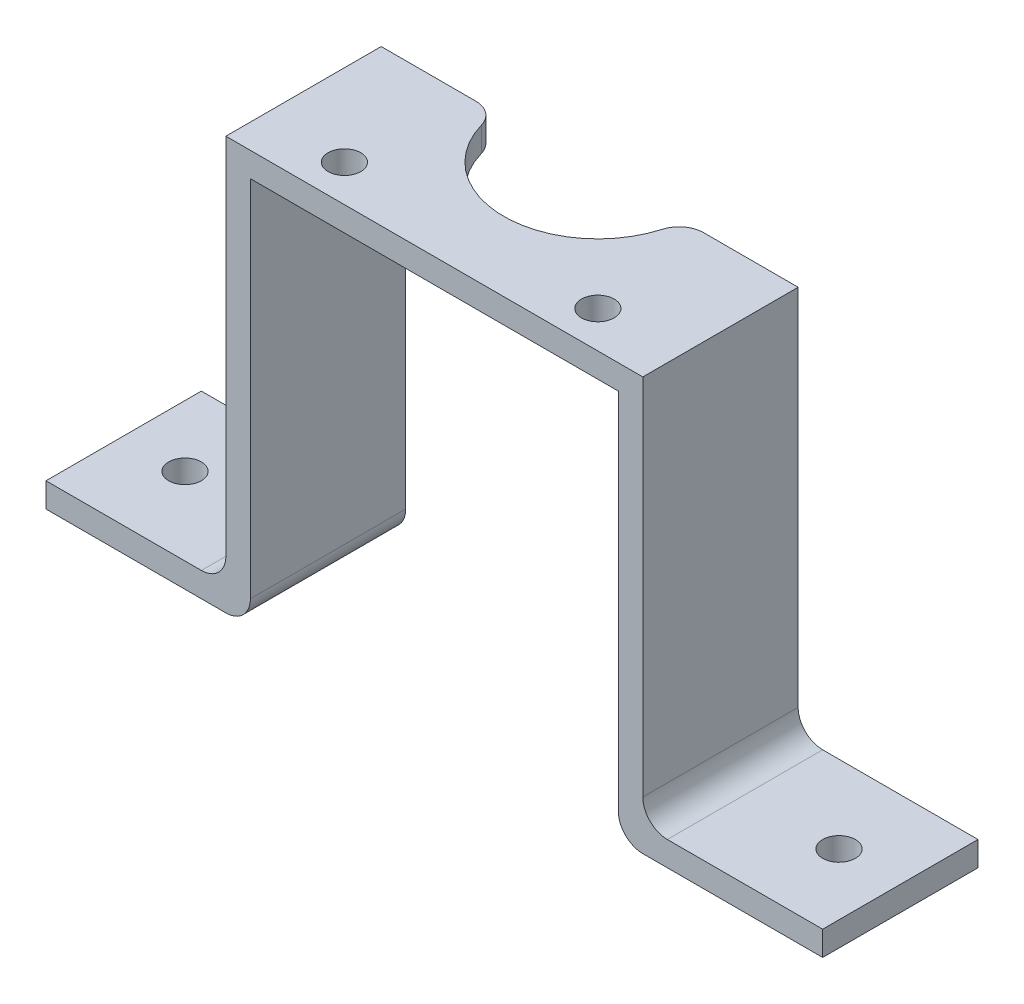
from build123d import *

# Parameters (mm, degrees)
EXTRUDE_THIN1_DEPTH = 4.5
SKETCH2_R           = 2
CUT_EXTRUDE1_DEPTH  = 70.474815581
BOSS_EXTRUDE1_DEPTH = 10
SKETCH4_R           = 11.5
CUT_EXTRUDE2_DEPTH  = 71.829019476
FILLET1_R           = 3
FILLET2_R           = 3
SKETCH5_R           = 2
CUT_EXTRUDE3_DEPTH  = 69.722267134


with BuildPart() as part:
    # Sketch1 → Extrude-Thin1 (new, symmetric)
    with BuildSketch(Plane.XY):
        Polygon((-47.5, 0), (-22.5, 0), (-22.5, 47.5), (0, 47.5), (0, 50.5), (-25.5, 50.5), (-25.5, 3), (-47.5, 3), align=None)
    extrude_thin1 = extrude(amount=EXTRUDE_THIN1_DEPTH, both=True)

    # Mirror1: Extrude-Thin1 across plane
    add(extrude_thin1.mirror(Plane(origin=(0, 50.5, 4.5), x_dir=(0, 0, 1), z_dir=(1, 0, 0))))

    # Sketch2 → Cut-Extrude1 (cut, through all)
    with BuildSketch(Plane(origin=(0, 50.5, 0), x_dir=(1, 0, 0), z_dir=(0, 1, 0))):
        with Locations(Location((-15.5, 0, 0), (0, 0, 270))):
            Circle(SKETCH2_R)
        with Locations(Location((15.5, 0, 0), (0, 0, 270))):
            Circle(SKETCH2_R)
    extrude(amount=-CUT_EXTRUDE1_DEPTH, mode=Mode.SUBTRACT)

    # Sketch3 → Boss-Extrude1 (add)
    with BuildSketch(Plane(origin=(0, 0, -4.5), x_dir=(-1, 0, 0), z_dir=(0, 0, -1))):
        Polygon((-22.5, 47.5), (22.5, 47.5), (22.5, 0), (47.5, 0), (47.5, 3), (25.5, 3), (25.5, 50.5), (-25.5, 50.5), (-25.5, 3), (-47.5, 3), (-47.5, 0), (-22.5, 0), align=None)
    extrude(amount=BOSS_EXTRUDE1_DEPTH)

    # Sketch4 → Cut-Extrude2 (cut, through all)
    with BuildSketch(Plane(origin=(0, 50.5, 0), x_dir=(1, 0, 0), z_dir=(0, 1, 0))):
        with Locations((0, 15.5)):
            Circle(SKETCH4_R)
    extrude(amount=-CUT_EXTRUDE2_DEPTH, mode=Mode.SUBTRACT)

    # Fillet1
    fillet1_edges = [part.edges().sort_by_distance(p)[0] for p in [
        (-11.456439237, 49, -14.5),
        (11.456439237, 49, -14.5),
    ]]
    fillet(fillet1_edges, radius=FILLET1_R)

    # Fillet2
    fillet2_edges = [part.edges().sort_by_distance(p)[0] for p in [
        (-22.5, 0, -5),
        (-25.5, 3, -5),
        (22.5, 0, -5),
        (25.5, 3, -5),
    ]]
    fillet(fillet2_edges, radius=FILLET2_R)

    # Sketch5 → Cut-Extrude3 (cut, through all)
    with BuildSketch(Plane(origin=(0, 3, 0), x_dir=(1, 0, 0), z_dir=(0, 1, 0))):
        with Locations(Location((-40, 5, 0), (0, 0, 270))):
            Circle(SKETCH5_R)
        with Locations(Location((40, 5, 0), (0, 0, 270))):
            Circle(SKETCH5_R)
    extrude(amount=-CUT_EXTRUDE3_DEPTH, mode=Mode.SUBTRACT)


solid = part.part
